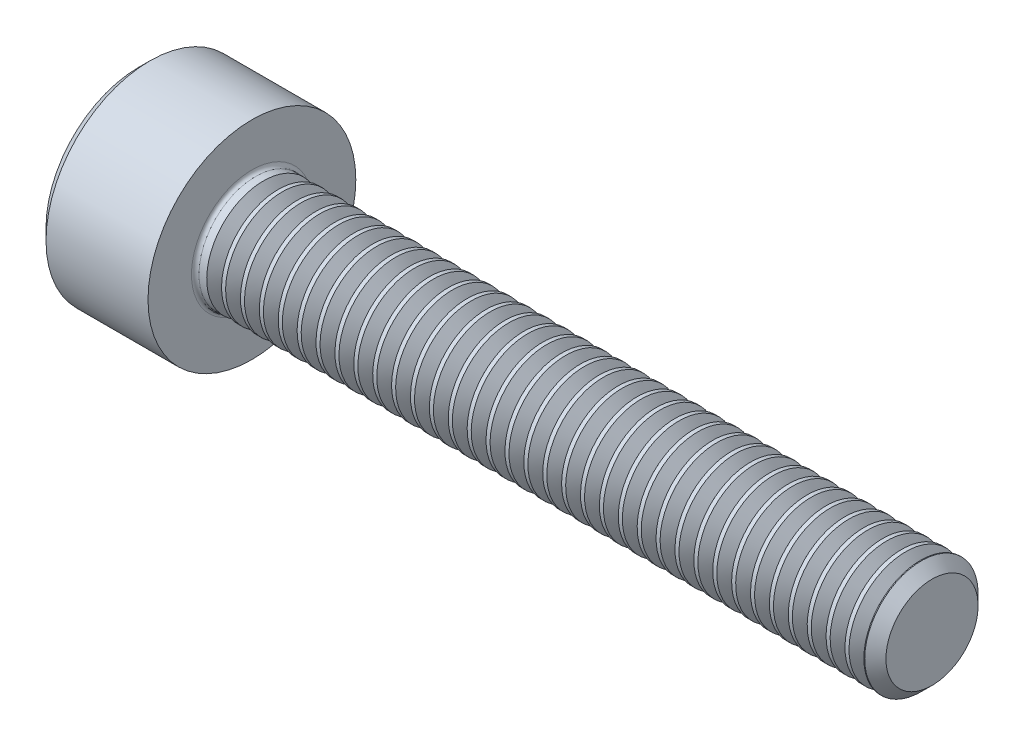
from build123d import *

# Parameters (mm, degrees)
FILLET1_R       = 0.1
HEX_2_DEPTH     = 1.3
THDSCHPAT_COUNT = 35
THDSCHPAT_PITCH = 0.5


with BuildPart() as part:
    # BodySke → Base-Revolve (revolve)
    with BuildSketch(Plane.XY, mode=Mode.PRIVATE) as base_revolve_sk:
        Polygon((0, 0), (0, 2.45), (0.3, 2.75), (3, 2.75), (3, 1.5), (20.7195, 1.5), (21, 1.2195), (21, 0), align=None)
    revolve(base_revolve_sk.sketch.rotate(Axis((-31.75, 0, 0), (1, 0, 0)), 90), axis=Axis((-31.75, 0, 0), (1, 0, 0)))

    # Fillet1
    fillet1_edges = [part.edges().sort_by_distance(p)[0] for p in [
        (3, 0, -1.5),
    ]]
    fillet(fillet1_edges, radius=FILLET1_R)

    # Sketch2 → Hex-PreBroach (revolve, cut)
    with BuildSketch(Plane.XY, mode=Mode.PRIVATE) as hex_prebroach_sk:
        Polygon((0, 1.28), (1.3, 1.28), (2.039008345, 0), (0, 0), align=None)
    revolve(hex_prebroach_sk.sketch.rotate(Axis((0, 0, 0), (1, 0, 0)), 90), axis=Axis((0, 0, 0), (1, 0, 0)), mode=Mode.SUBTRACT)

    # Sketch3 → Hex 2 (cut)
    with BuildSketch(Plane(origin=(0, 0, 0), x_dir=(0, 0.500000000000001, 0.866025403784438), z_dir=(-1, 0, 0))):
        Polygon((0.739008345, 1.28), (-0.739008345, 1.28), (-1.478016689, 0), (-0.739008345, -1.28), (0.739008345, -1.28), (1.478016689, 0), align=None)
    extrude(amount=-HEX_2_DEPTH, mode=Mode.SUBTRACT)

    # ThdSchSke → ThreadSchematic (revolve, cut)
    with BuildSketch(Plane.XY):
        Polygon((3.5, -1.2195), (3.303591786, -1.5), (3.303591786, -1.875), (3.696408214, -1.875), (3.696408214, -1.5), align=None)
    threadschematic = revolve(axis=Axis((-3.175, 0, 0), (1, 0, 0)), mode=Mode.SUBTRACT)

    # ThdSchPat: ThreadSchematic ×35
    with Locations(*[(i * THDSCHPAT_PITCH, 0, 0) for i in range(1, THDSCHPAT_COUNT)]):
        add(threadschematic, mode=Mode.SUBTRACT)


solid = part.part
